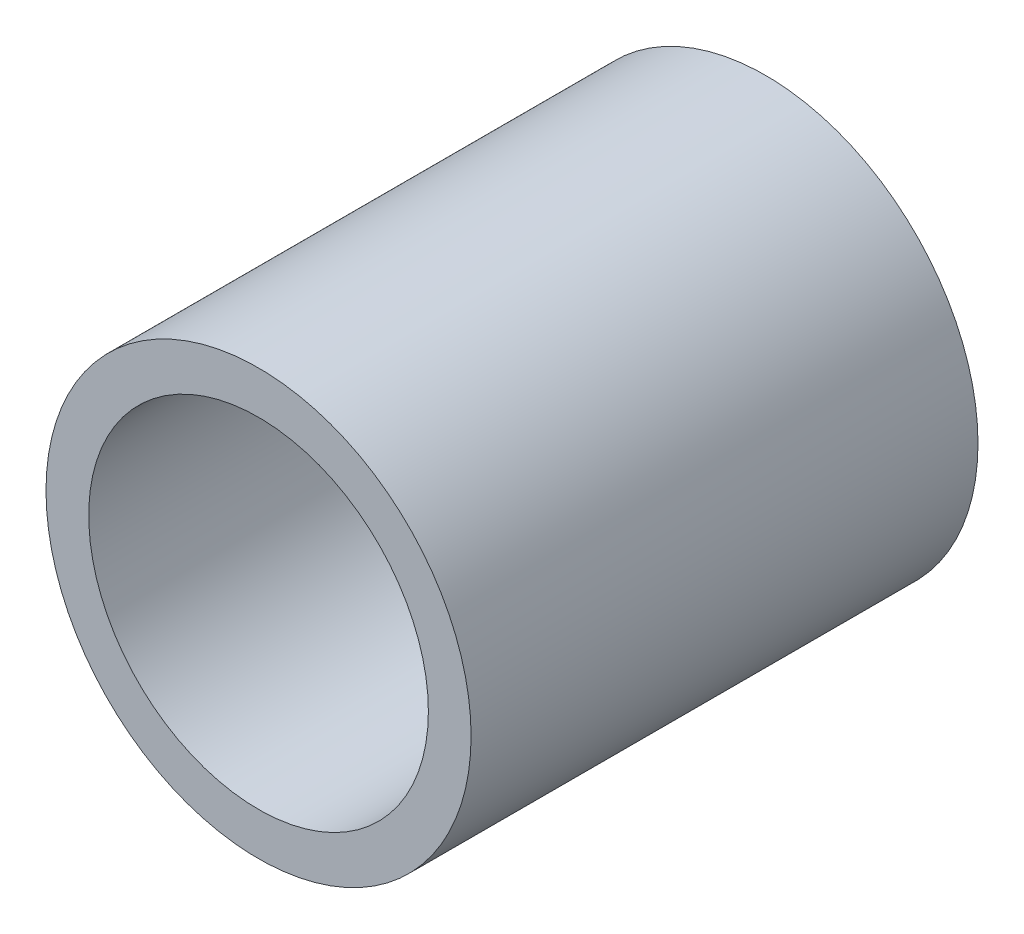
from build123d import *

# Parameters (mm, degrees)
CROQUIS1_R              = 10.65
CROQUIS1_R_2            = 8.51
SALIENTE_EXTRUIR1_DEPTH = 25.4


with BuildPart() as part:
    # Croquis1 → Saliente-Extruir1 (new body)
    with BuildSketch(Plane.XY):
        Circle(CROQUIS1_R)
        Circle(CROQUIS1_R_2, mode=Mode.SUBTRACT)
    extrude(amount=SALIENTE_EXTRUIR1_DEPTH)


solid = part.part
